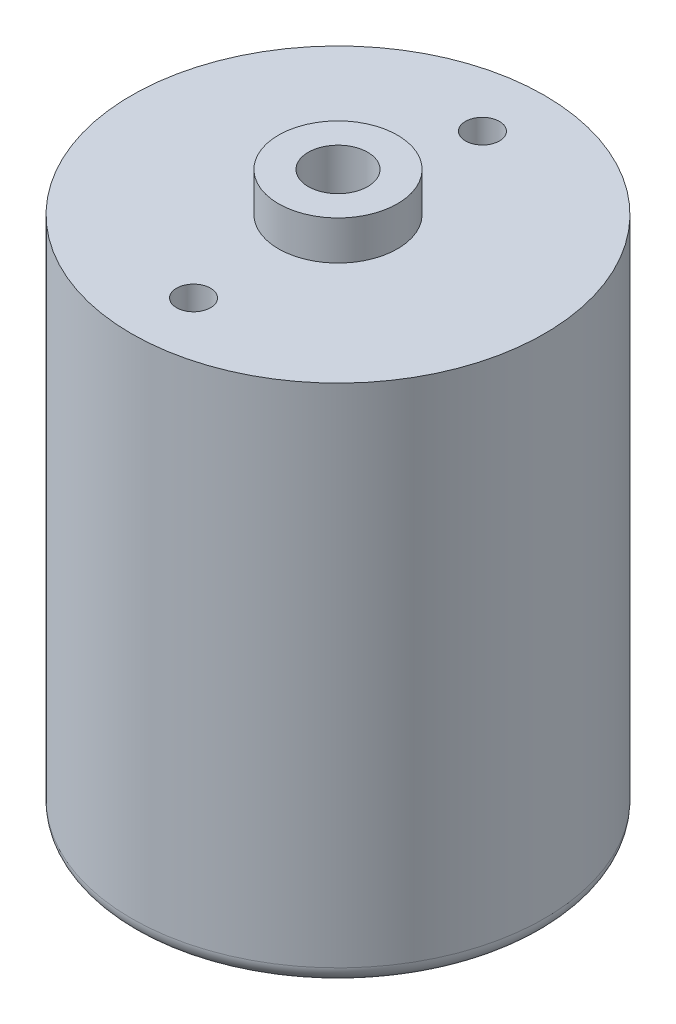
from build123d import *

# Parameters (mm, degrees)
SKETCH_1_R           = 12.15
EXTRUDE_1_DEPTH      = 30.8
FILLET_1_R           = 1
EXTRUDE_2_DEPTH      = 2.3
EXTRUDE_2_DEPTH_BACK = 30.8
SKETCH_2_R           = 3.5
SKETCH_3_R           = 1
CUT_EXTRUDE_1_DEPTH  = 36.268753911
SKETCH_4_R           = 1.75
CUT_EXTRUDE_2_DEPTH  = 38.294168478


with BuildPart() as part:
    # 草图1 → 凸台-拉伸1 (new body)
    with BuildSketch(Plane(origin=(0, 0, 0), x_dir=(1, 0, 0), z_dir=(0, 1, 0))):
        with Locations(Location((0, 0, 0), (0, 0, 90))):
            Circle(SKETCH_1_R)
    extrude(amount=EXTRUDE_1_DEPTH)

    # 圆角1
    fillet_1_edges = [part.edges().sort_by_distance(p)[0] for p in [
        (0, 0, 12.15),
    ]]
    fillet(fillet_1_edges, radius=FILLET_1_R)

    # 草图2 → 凸台-拉伸2 (add, two sides: drawn at the far end of the back side and taken through both)
    with BuildSketch(Plane(origin=(0, 30.8, 0), x_dir=(1, 0, 0), z_dir=(0, 1, 0)).offset(-EXTRUDE_2_DEPTH_BACK)):
        with Locations(Location((0, 0, 0), (0, 0, 270))):
            Circle(SKETCH_2_R)
    extrude(amount=EXTRUDE_2_DEPTH + EXTRUDE_2_DEPTH_BACK)

    # 草图3 → 切除-拉伸1 (cut, through all)
    with BuildSketch(Plane(origin=(0, 30.8, 0), x_dir=(1, 0, 0), z_dir=(0, 1, 0))):
        with Locations(Location((0, 8.5, 0), (0, 0, 270))):
            Circle(SKETCH_3_R)
        with Locations(Location((0, -8.5, 0), (0, 0, 270))):
            Circle(SKETCH_3_R)
    extrude(amount=-CUT_EXTRUDE_1_DEPTH, mode=Mode.SUBTRACT)

    # 草图4 → 切除-拉伸2 (cut, through all)
    with BuildSketch(Plane(origin=(0, 33.1, 0), x_dir=(1, 0, 0), z_dir=(0, 1, 0))):
        with Locations(Location((0, 0, 0), (0, 0, 270))):
            Circle(SKETCH_4_R)
    extrude(amount=-CUT_EXTRUDE_2_DEPTH, mode=Mode.SUBTRACT)


solid = part.part
